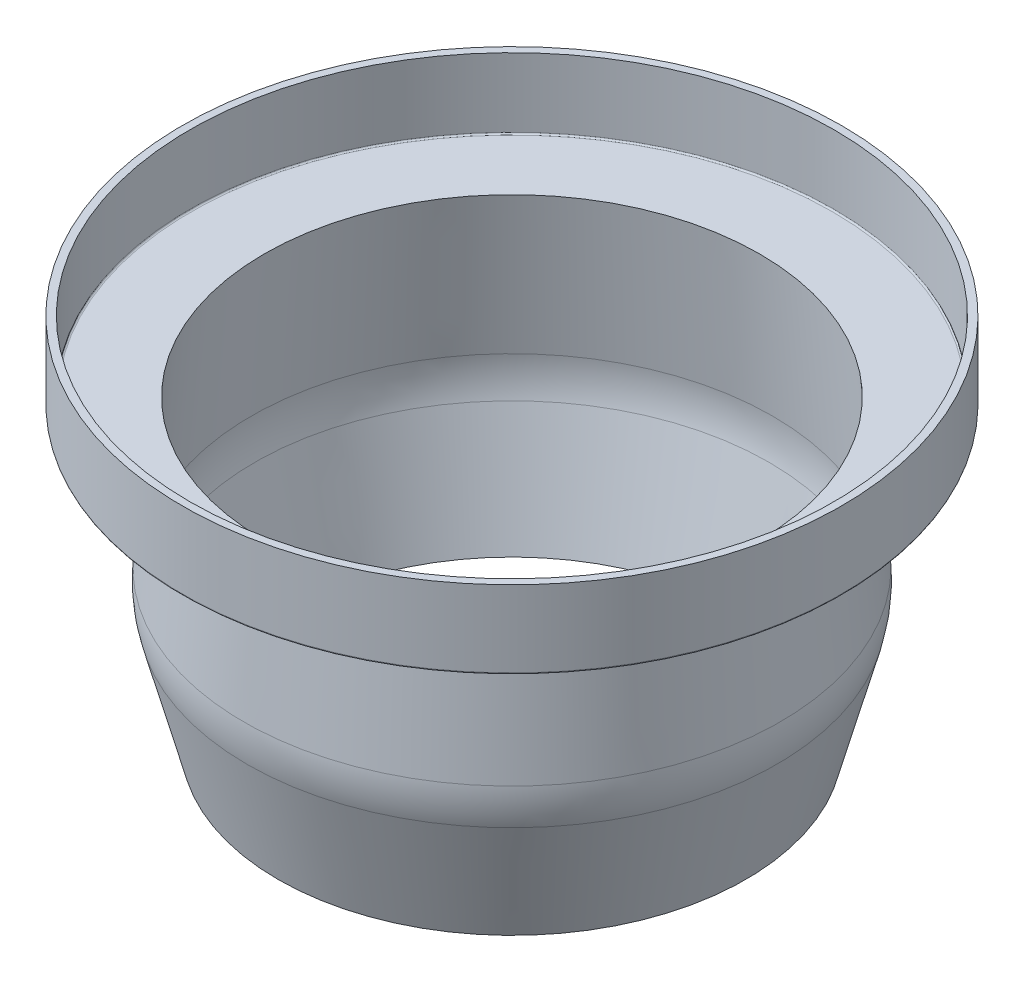
from build123d import *


with BuildPart() as part:
    # Çizim1 → Döndür1 (revolve)
    with BuildSketch(Plane.XY, mode=Mode.PRIVATE) as d_nd_r1_sk:
        with BuildLine():
            Line((-44.5, 30.888888889), (-44.5, 20.588888889))
            ThreePointArc((-44.5, 20.588888889), (-44.441421356, 20.447467533), (-44.3, 20.388888889))
            Line((-44.3, 20.388888889), (-34.545654251, 20.388888889))
            Line((-34.545654251, 20.388888889), (-36.200013267, 1.479478808))
            ThreePointArc((-36.200013267, 1.479478808), (-36.200013267, -1.135193474), (-35.74598019, -3.710143009))
            Line((-35.74598019, -3.710143009), (-31.584628047, -19.240520634))
            Line((-31.584628047, -19.240520634), (-30.618702221, -18.981701589))
            Line((-30.618702221, -18.981701589), (-34.734417582, -3.621642749))
            ThreePointArc((-34.734417582, -3.621642749), (-35.188450659, -1.046693214), (-35.188450659, 1.567979069))
            Line((-35.188450659, 1.567979069), (-33.454345749, 21.388888889))
            Line((-33.454345749, 21.388888889), (-43.3, 21.388888889))
            ThreePointArc((-43.3, 21.388888889), (-43.441421356, 21.447467533), (-43.5, 21.588888889))
            Line((-43.5, 21.588888889), (-43.5, 30.888888889))
            Line((-43.5, 30.888888889), (-44.5, 30.888888889))
        make_face()
    revolve(d_nd_r1_sk.sketch.rotate(Axis((0, 0, 0), (0, 1, 0)), 270), axis=Axis((0, 0, 0), (0, 1, 0)))


solid = part.part
